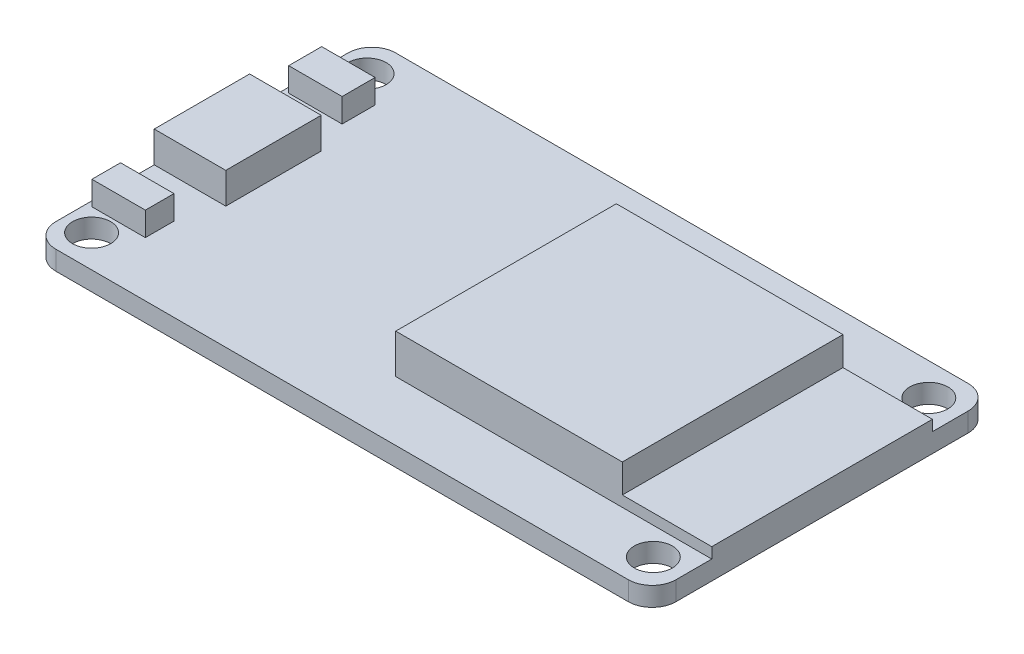
from build123d import *

# Parameters (mm, degrees)
SKETCH1_W           = 52
SKETCH1_H           = 28.5
SKETCH1_R           = 1.6
BOSS_EXTRUDE1_DEPTH = 1.6
FILLET1_R           = 2
SKETCH2_W           = 6
SKETCH2_H           = 8
BOSS_EXTRUDE2_DEPTH = 2.6
SKETCH3_W           = 26.5
SKETCH3_H           = 18.5
BOSS_EXTRUDE3_DEPTH = 0.9
SKETCH4_W           = 19
SKETCH4_H           = 18.5
BOSS_EXTRUDE4_DEPTH = 2.4
SKETCH5_W           = 4.480247742
SKETCH5_H           = 2.767211841
SKETCH5_H_2         = 2.398250262
BOSS_EXTRUDE5_DEPTH = 2


with BuildPart() as part:
    # Sketch1 → Boss-Extrude1 (new body)
    with BuildSketch(Plane(origin=(0, 0, 0), x_dir=(1, 0, 0), z_dir=(0, 1, 0))):
        Rectangle(SKETCH1_W, SKETCH1_H)
        with Locations(Location((-23.7, 11.55, 0), (0, 0, 270))):
            Circle(SKETCH1_R, mode=Mode.SUBTRACT)
        with Locations(Location((-23.7, -11.55, 0), (0, 0, 270))):
            Circle(SKETCH1_R, mode=Mode.SUBTRACT)
        with Locations(Location((23.4, 11.55, 0), (0, 0, 270))):
            Circle(SKETCH1_R, mode=Mode.SUBTRACT)
        with Locations(Location((23.4, -11.55, 0), (0, 0, 270))):
            Circle(SKETCH1_R, mode=Mode.SUBTRACT)
    extrude(amount=BOSS_EXTRUDE1_DEPTH)

    # Fillet1
    fillet1_edges = [part.edges().sort_by_distance(p)[0] for p in [
        (-26, 0.8, -14.25),
        (26, 0.8, -14.25),
        (26, 0.8, 14.25),
        (-26, 0.8, 14.25),
    ]]
    fillet(fillet1_edges, radius=FILLET1_R)

    # Sketch2 → Boss-Extrude2 (add)
    with BuildSketch(Plane(origin=(0, 1.6, 0), x_dir=(1, 0, 0), z_dir=(0, 1, 0))):
        with Locations((-23, 0)):
            Rectangle(SKETCH2_W, SKETCH2_H)
    extrude(amount=BOSS_EXTRUDE2_DEPTH)

    # Sketch3 → Boss-Extrude3 (add)
    with BuildSketch(Plane(origin=(0, 1.6, 0), x_dir=(1, 0, 0), z_dir=(0, 1, 0))):
        with Locations((12.75, 0)):
            Rectangle(SKETCH3_W, SKETCH3_H)
    extrude(amount=BOSS_EXTRUDE3_DEPTH)

    # Sketch4 → Boss-Extrude4 (add)
    with BuildSketch(Plane(origin=(0, 2.5, 0), x_dir=(1, 0, 0), z_dir=(0, 1, 0))):
        with Locations((9, 0)):
            Rectangle(SKETCH4_W, SKETCH4_H)
    extrude(amount=BOSS_EXTRUDE4_DEPTH)

    # Sketch5 → Boss-Extrude5 (add)
    with BuildSketch(Plane(origin=(0, 1.6, 0), x_dir=(1, 0, 0), z_dir=(0, 1, 0))):
        with Locations((-23.323642657, 8.222572326)):
            Rectangle(SKETCH5_W, SKETCH5_H)
        with Locations((-23.323642657, -8.459761913)):
            Rectangle(SKETCH5_W, SKETCH5_H_2)
    extrude(amount=BOSS_EXTRUDE5_DEPTH)


solid = part.part
